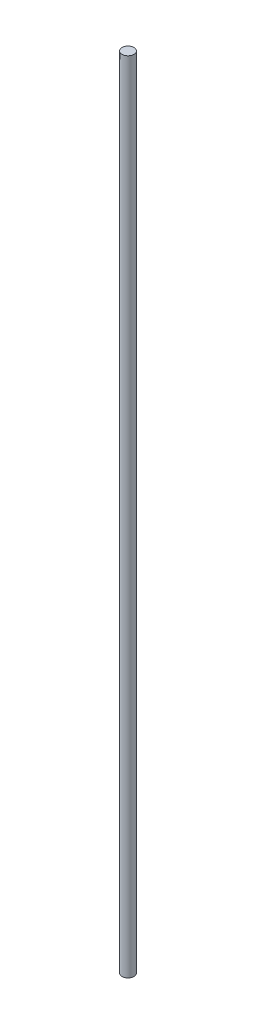
from build123d import *

# Parameters (mm, degrees)
SKETCH1_R           = 1.5
BOSS_EXTRUDE1_DEPTH = 100


with BuildPart() as part:
    # Sketch1 → Boss-Extrude1 (new, symmetric)
    with BuildSketch(Plane(origin=(0, 0, 0), x_dir=(1, 0, 0), z_dir=(0, 1, 0))):
        with Locations(Location((0, 0, 0), (0, 0, 270))):
            Circle(SKETCH1_R)
    extrude(amount=BOSS_EXTRUDE1_DEPTH, both=True)


solid = part.part
